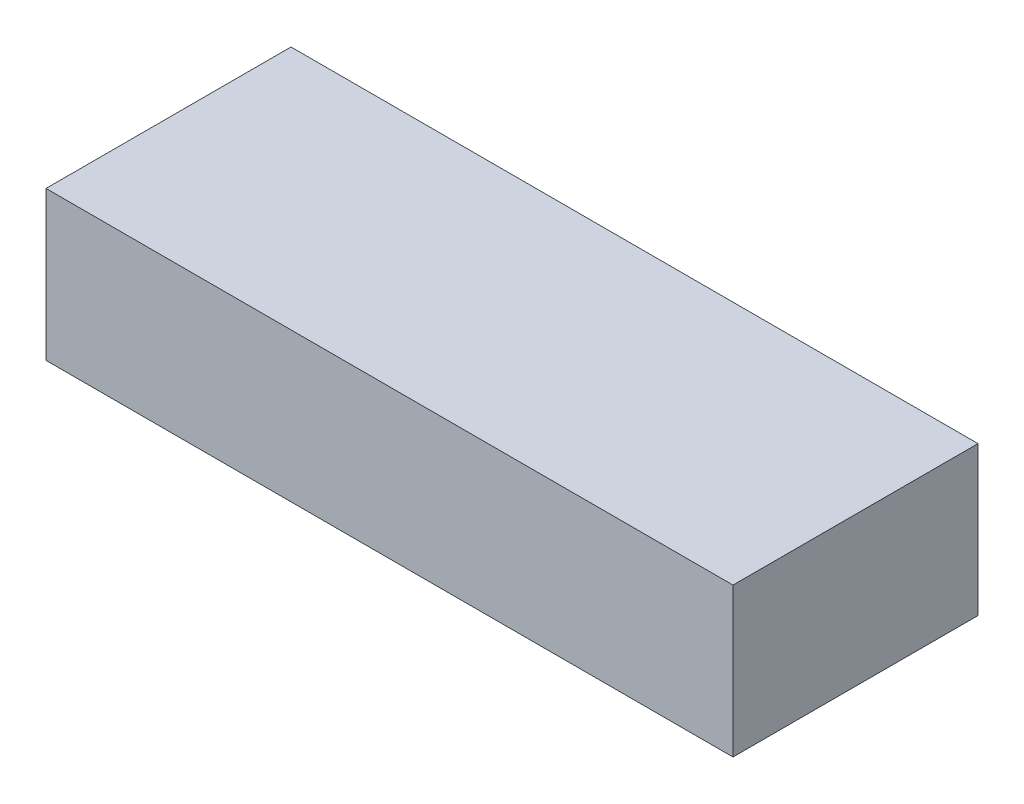
from build123d import *

# Parameters (mm, degrees)
SCHIZZO1_W                   = 143
SCHIZZO1_H                   = 51
ESTRUSIONE_ESTRUSIONE1_DEPTH = 31


with BuildPart() as part:
    # Schizzo1 → Estrusione-Estrusione1 (new body)
    with BuildSketch(Plane(origin=(0, 0, 0), x_dir=(1, 0, 0), z_dir=(0, 1, 0))):
        Rectangle(SCHIZZO1_W, SCHIZZO1_H)
    extrude(amount=ESTRUSIONE_ESTRUSIONE1_DEPTH)


solid = part.part
